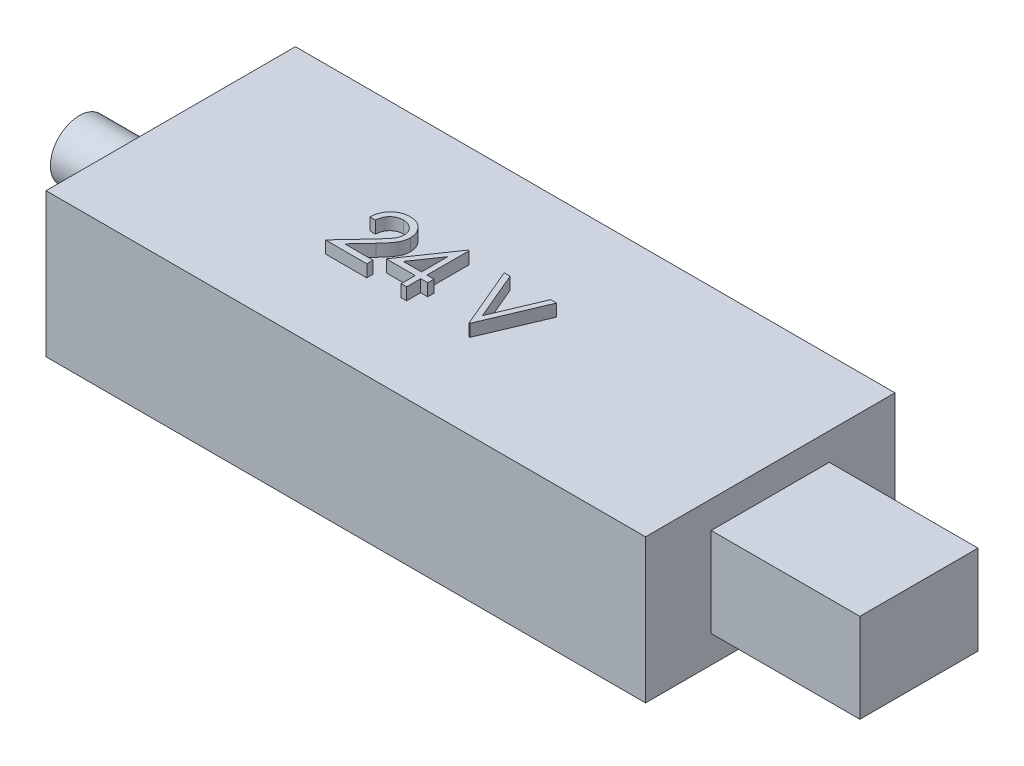
from build123d import *

# Parameters (mm, degrees)
SKETCH1_W           = 125
SKETCH1_H           = 52
BOSS_EXTRUDE1_DEPTH = 30
SKETCH2_W           = 24.62687601
SKETCH2_H           = 18.598470566
BOSS_EXTRUDE2_DEPTH = 31
SKETCH3_R           = 6.039414619
BOSS_EXTRUDE3_DEPTH = 19.05
BOSS_EXTRUDE4_DEPTH = 2.54


with BuildPart() as part:
    # Sketch1 → Boss-Extrude1 (new body)
    with BuildSketch(Plane(origin=(0, 0, 0), x_dir=(1, 0, 0), z_dir=(0, 1, 0))):
        Rectangle(SKETCH1_W, SKETCH1_H)
    extrude(amount=BOSS_EXTRUDE1_DEPTH)

    # Sketch2 → Boss-Extrude2 (add)
    with BuildSketch(Plane(origin=(62.5, 0, 0), x_dir=(0, 0, -1), z_dir=(1, 0, 0))):
        with Locations((0, 15)):
            Rectangle(SKETCH2_W, SKETCH2_H)
    extrude(amount=BOSS_EXTRUDE2_DEPTH)

    # Sketch3 → Boss-Extrude3 (add)
    with BuildSketch(Plane.ZY.offset(62.5)):
        with Locations(Location((0, 15, 0), (0, 0, 180))):
            Circle(SKETCH3_R)
    extrude(amount=BOSS_EXTRUDE3_DEPTH)

    # Sketch4 → Boss-Extrude4 (add)
    # profile 1 of 3: a face of its own
    with BuildSketch(Plane(origin=(0, 30, 0), x_dir=(1, 0, 0), z_dir=(0, 1, 0))):
        with BuildLine():
            Line((-20.314153968, 0.487864775), (-21.453897558, 0.487864775))
            add(Edge.make_bspline(
                [(-21.453897558, 0.487864775), (-21.446469317, 0.639070568), (-21.431880449, 0.936034721), (-21.363560657, 1.369010039), (-21.26580376, 1.782866023), (-21.127586198, 2.17427971), (-20.95593199, 2.546711954), (-20.750083034, 2.898683439), (-20.506265347, 3.228851467), (-20.22974377, 3.53415527), (-19.929411851, 3.814235884), (-19.60535887, 4.056099193), (-19.264835486, 4.260451887), (-18.908874809, 4.431289536), (-18.533460764, 4.559522691), (-18.142000109, 4.654669783), (-17.732772957, 4.71191538), (-17.453953448, 4.71806866), (-17.312150763, 4.721198109)],
                knots=[0, 0, 0, 0, 1.10065271, 2.161652631, 3.183658789, 4.190468796, 5.17591951, 6.163126047, 7.15150782, 8.156236427, 9.156009102, 10.134482811, 11.092018607, 12.041330605, 13.001268258, 13.972401359, 14.968799086, 16, 16, 16, 16], degree=3))
            add(Edge.make_bspline(
                [(-17.312150763, 4.721198109), (-17.17289318, 4.717937995), (-16.899257003, 4.711531989), (-16.499889122, 4.656519111), (-16.119697225, 4.570356536), (-15.759424473, 4.449469168), (-15.421945324, 4.286965675), (-15.104724562, 4.091757463), (-14.80398562, 3.865988361), (-14.533269577, 3.600181666), (-14.284683118, 3.316418728), (-14.070226364, 3.013476906), (-13.886572885, 2.700587784), (-13.733491875, 2.375365452), (-13.620802456, 2.034747721), (-13.535247244, 1.683693585), (-13.486887772, 1.318569271), (-13.479465807, 1.071439769), (-13.47569243, 0.945797468)],
                knots=[0, 0, 0, 0, 1.111607364, 2.184268762, 3.212621178, 4.221274766, 5.211760367, 6.196651075, 7.1921475, 8.207485113, 9.220403448, 10.201281604, 11.166441695, 12.114753415, 13.065576456, 14.026450734, 14.996634279, 16, 16, 16, 16], degree=3))
            add(Edge.make_bspline(
                [(-13.47569243, 0.945797468), (-13.481836555, 0.768912468), (-13.494016985, 0.41824655), (-13.598209151, -0.097064524), (-13.76093792, -0.596332073), (-13.956871186, -0.998150283), (-14.15452834, -1.321940389), (-14.332645868, -1.588526833), (-14.541161039, -1.875566675), (-14.783108732, -2.182098728), (-15.053484011, -2.510524012), (-15.354735861, -2.860644127), (-15.689012495, -3.228841692), (-15.923630484, -3.480322017), (-16.045203648, -3.610632821)],
                knots=[0, 0, 0, 0, 1.184426356, 2.348067706, 3.509069118, 4.696110526, 5.333549288, 6.050745305, 6.844228056, 7.710549037, 8.667450064, 9.695053472, 10.805634456, 12, 12, 12, 12], degree=3))
            Line((-16.045203648, -3.610632821), (-19.222747718, -7.001878814))
            Line((-19.222747718, -7.001878814), (-13.312871917, -7.001878814))
            Line((-13.312871917, -7.001878814), (-13.312871917, -8.304442917))
            Line((-13.312871917, -8.304442917), (-21.942359096, -8.304442917))
            Line((-21.942359096, -8.304442917), (-17.017038583, -3.048393237))
            add(Edge.make_bspline(
                [(-17.017038583, -3.048393237), (-16.897121966, -2.923213668), (-16.666786684, -2.682769334), (-16.341004191, -2.331730593), (-16.048399862, -2.006067973), (-15.787079609, -1.706396783), (-15.562712318, -1.428333666), (-15.363604505, -1.180884313), (-15.204072217, -0.953175307), (-15.030933496, -0.689230794), (-14.863242763, -0.366968957), (-14.719143643, 0.026853286), (-14.631278336, 0.432263603), (-14.620737932, 0.706228138), (-14.615436019, 0.844034647)],
                knots=[0, 0, 0, 0, 1.329631726, 2.553950428, 3.673215718, 4.687767853, 5.603093632, 6.413772471, 7.123043292, 7.734684054, 8.834405432, 9.900288307, 10.943827018, 12, 12, 12, 12], degree=3))
            add(Edge.make_bspline(
                [(-14.615436019, 0.844034647), (-14.617742856, 0.930690007), (-14.622289187, 1.101471081), (-14.662412832, 1.351863407), (-14.723048097, 1.593398589), (-14.809935176, 1.826819578), (-14.92462249, 2.049779515), (-15.064225898, 2.262549801), (-15.225298413, 2.46824976), (-15.411630162, 2.661120299), (-15.616323391, 2.83776353), (-15.832565383, 2.994242354), (-16.061347189, 3.125012842), (-16.301704204, 3.232213532), (-16.552966336, 3.316307058), (-16.815619554, 3.37457676), (-17.088938127, 3.411161774), (-17.27556824, 3.416111769), (-17.370664385, 3.418634006)],
                knots=[0, 0, 0, 0, 0.991446411, 1.95395049, 2.89581595, 3.838931463, 4.798493298, 5.75982156, 6.748411868, 7.785213223, 8.824556874, 9.840280684, 10.836137867, 11.835679398, 12.848801643, 13.863922112, 14.911575587, 16, 16, 16, 16], degree=3))
            add(Edge.make_bspline(
                [(-17.370664385, 3.418634006), (-17.469981406, 3.416039461), (-17.665023638, 3.410944201), (-17.951386986, 3.375301963), (-18.224566808, 3.313812771), (-18.485250284, 3.229714553), (-18.733878496, 3.122822104), (-18.969242313, 2.989683488), (-19.190813368, 2.830811955), (-19.399008181, 2.650687651), (-19.590828905, 2.450145212), (-19.759364712, 2.226589061), (-19.906626706, 1.984101011), (-20.035111639, 1.723335356), (-20.139453714, 1.441925925), (-20.21918486, 1.140871682), (-20.282274275, 0.821479812), (-20.303350907, 0.60091679), (-20.314153968, 0.487864775)],
                knots=[0, 0, 0, 0, 1.031018746, 2.02475058, 2.990194455, 3.934040569, 4.864654155, 5.795059489, 6.735614925, 7.690564532, 8.649604399, 9.611025574, 10.590972636, 11.591080095, 12.624614302, 13.701020113, 14.821632451, 16, 16, 16, 16], degree=3))
        make_face()
    # profile 2 of 3: a face of its own
    with BuildSketch(Plane(origin=(0, 30, 0), x_dir=(1, 0, 0), z_dir=(0, 1, 0))):
        Polygon((-5.24053618, 4.721198109), (-5.009025763, 4.721198109), (-5.009025763, -4.071109584), (-3.543641148, -4.071109584), (-3.543641148, -5.373673686), (-5.009025763, -5.373673686), (-5.009025763, -8.304442917), (-6.148769353, -8.304442917), (-6.148769353, -5.373673686), (-12.173128327, -5.373673686), align=None)
        Polygon((-6.148769353, -4.071109584), (-6.148769353, 1.444435288), (-9.934346276, -4.071109584), align=None, mode=Mode.SUBTRACT)
    # profile 3 of 3: a face of its own
    with BuildSketch(Plane(origin=(0, 30, 0), x_dir=(1, 0, 0), z_dir=(0, 1, 0))):
        Polygon((2.64353834, 4.395557083), (3.864692186, 4.395557083), (8.098025519, -5.612816314), (12.331358852, 4.395557083), (13.552512699, 4.395557083), (8.179435776, -8.304442917), (8.016615263, -8.304442917), align=None)
    extrude(amount=BOSS_EXTRUDE4_DEPTH)


solid = part.part
